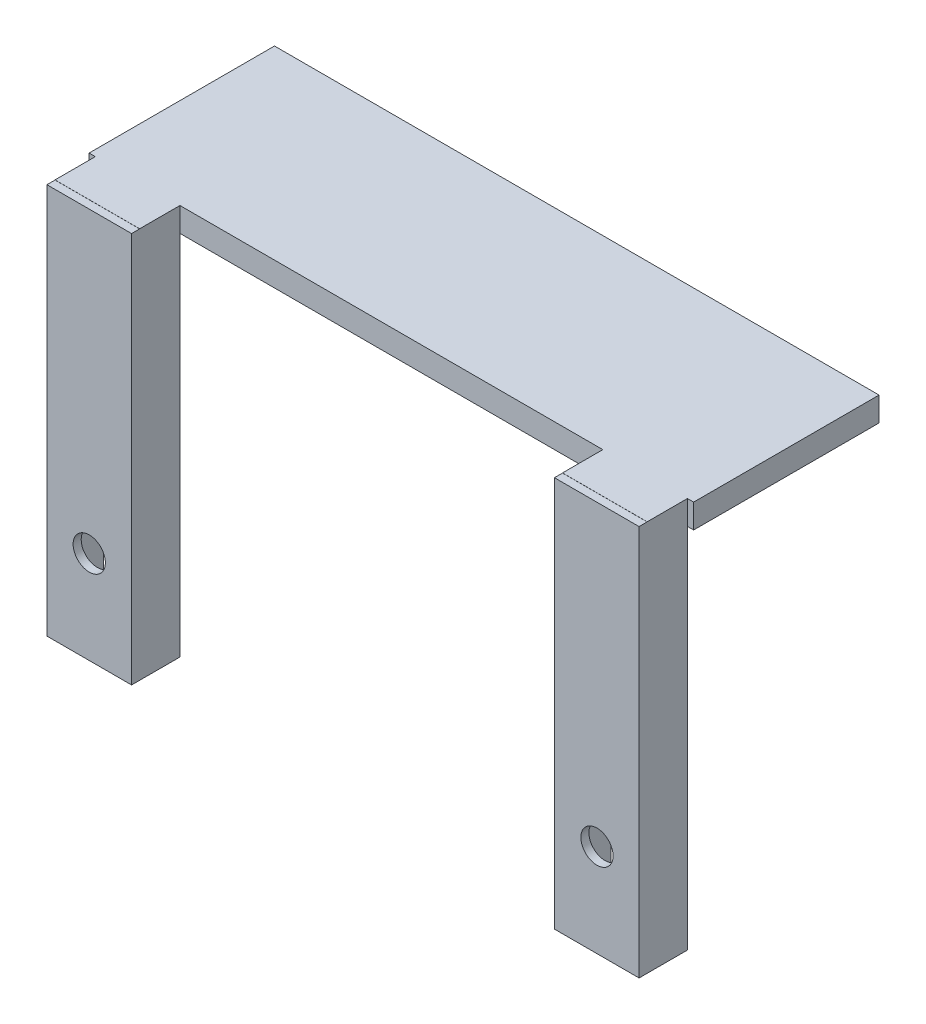
from build123d import *

# Parameters (mm, degrees)
SKETCH1_W           = 75
SKETCH1_H           = 23
BOSS_EXTRUDE1_DEPTH = 3
BOSS_EXTRUDE4_DEPTH = 5
SKETCH3_W           = 10.5
SKETCH3_H           = 1
BOSS_EXTRUDE5_DEPTH = 48.5
SKETCH4_R           = 2
CUT_EXTRUDE1_DEPTH  = 66.282886378


with BuildPart() as part:
    # Sketch1 → Boss-Extrude1 (new body)
    with BuildSketch(Plane(origin=(0, 0, 0), x_dir=(1, 0, 0), z_dir=(0, 1, 0))):
        Rectangle(SKETCH1_W, SKETCH1_H)
    extrude(amount=BOSS_EXTRUDE1_DEPTH)

    # Sketch2 → Boss-Extrude4 (add)
    with BuildSketch(Plane.XY.offset(11.5)):
        Polygon((27.230257431, 0), (27.230257431, -45.514890462), (26.230257431, -45.514890462), (26.230257431, 3), (36.730257431, 3), (36.730257431, -45.514890462), (35.730257431, -45.514890462), (35.730257431, 0), align=None)
        Polygon((-35.730257431, -45.514890462), (-36.730257431, -45.514890462), (-36.730257431, 3), (-26.230257431, 3), (-26.230257431, -45.514890462), (-27.230257431, -45.514890462), (-27.230257431, 0), (-35.730257431, 0), align=None)
    extrude(amount=BOSS_EXTRUDE4_DEPTH)

    # Sketch3 → Boss-Extrude5 (add)
    with BuildSketch(Plane.XZ.offset(45.514890462)):
        with Locations((-31.480257431, 17)):
            Rectangle(SKETCH3_W, SKETCH3_H)
        with Locations((31.480257431, 17)):
            Rectangle(SKETCH3_W, SKETCH3_H)
    extrude(amount=-BOSS_EXTRUDE5_DEPTH)

    # Sketch4 → Cut-Extrude1 (cut, through all)
    with BuildSketch(Plane(origin=(0, 0, 16.5), x_dir=(-1, 0, 0), z_dir=(0, 0, -1))):
        with Locations((31.481258109, -34.012149814)):
            Circle(SKETCH4_R)
        with Locations((-31.503449984, -34.014890462)):
            Circle(SKETCH4_R)
    extrude(amount=-CUT_EXTRUDE1_DEPTH, mode=Mode.SUBTRACT)


solid = part.part
